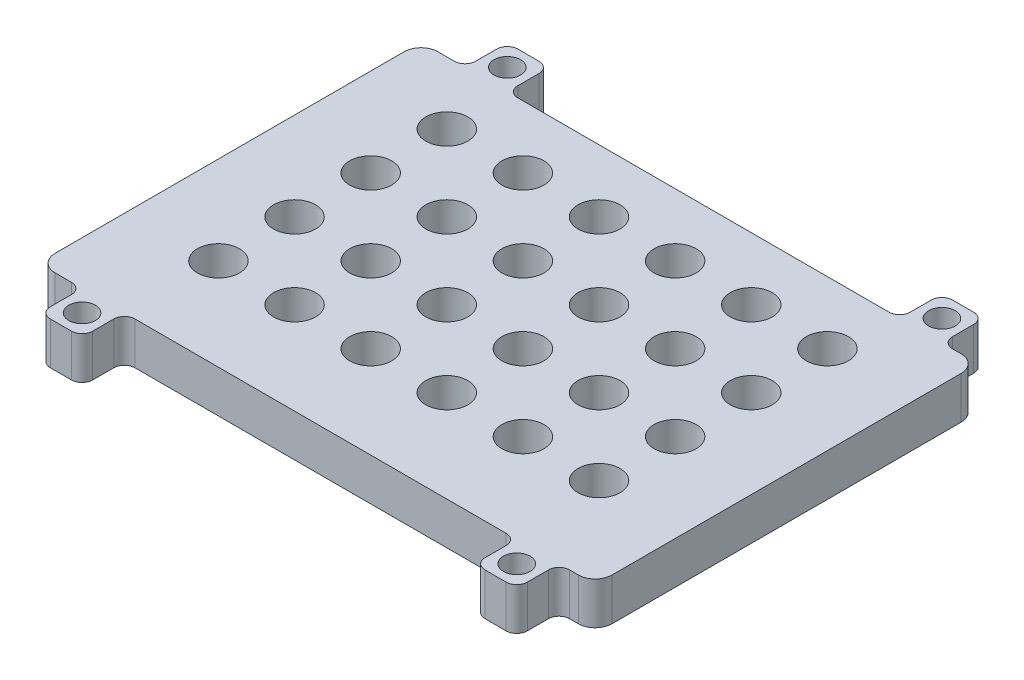
from build123d import *

# Parameters (mm, degrees)
SKETCH1_W           = 131.727
SKETCH1_H           = 90.551
SKETCH1_R           = 3.5
BOSS_EXTRUDE1_DEPTH = 10
SKETCH3_W           = 10
SKETCH3_H           = 10
BOSS_EXTRUDE3_DEPTH = 10
SKETCH4_R           = 3.15
CUT_EXTRUDE2_DEPTH  = 87.564320205
FILLET2_R           = 2.5
FILLET3_R           = 4
SKETCH5_R           = 4.975
CUT_EXTRUDE3_DEPTH  = 9.5


with BuildPart() as part:
    # Sketch1 → Boss-Extrude1 (new body)
    with BuildSketch(Plane(origin=(0, 0, 0), x_dir=(1, 0, 0), z_dir=(0, 1, 0))):
        Rectangle(SKETCH1_W, SKETCH1_H)
        with Locations(Location((-45, 30.5, 0), (0, 0, 270))):
            Circle(SKETCH1_R, mode=Mode.SUBTRACT)
        with Locations(Location((-27, 30.5, 0), (0, 0, 270))):
            Circle(SKETCH1_R, mode=Mode.SUBTRACT)
        with Locations(Location((-9, 30.5, 0), (0, 0, 270))):
            Circle(SKETCH1_R, mode=Mode.SUBTRACT)
        with Locations(Location((9, 30.5, 0), (0, 0, 270))):
            Circle(SKETCH1_R, mode=Mode.SUBTRACT)
        with Locations(Location((27, 30.5, 0), (0, 0, 270))):
            Circle(SKETCH1_R, mode=Mode.SUBTRACT)
        with Locations(Location((45, 30.5, 0), (0, 0, 270))):
            Circle(SKETCH1_R, mode=Mode.SUBTRACT)
        with Locations(Location((-27, 12.5, 0), (0, 0, 270))):
            Circle(SKETCH1_R, mode=Mode.SUBTRACT)
        with Locations(Location((-9, 12.5, 0), (0, 0, 270))):
            Circle(SKETCH1_R, mode=Mode.SUBTRACT)
        with Locations(Location((9, 12.5, 0), (0, 0, 270))):
            Circle(SKETCH1_R, mode=Mode.SUBTRACT)
        with Locations(Location((27, 12.5, 0), (0, 0, 270))):
            Circle(SKETCH1_R, mode=Mode.SUBTRACT)
        with Locations(Location((45, 12.5, 0), (0, 0, 270))):
            Circle(SKETCH1_R, mode=Mode.SUBTRACT)
        with Locations(Location((-27, -5.5, 0), (0, 0, 270))):
            Circle(SKETCH1_R, mode=Mode.SUBTRACT)
        with Locations(Location((-9, -5.5, 0), (0, 0, 270))):
            Circle(SKETCH1_R, mode=Mode.SUBTRACT)
        with Locations(Location((9, -5.5, 0), (0, 0, 270))):
            Circle(SKETCH1_R, mode=Mode.SUBTRACT)
        with Locations(Location((27, -5.5, 0), (0, 0, 270))):
            Circle(SKETCH1_R, mode=Mode.SUBTRACT)
        with Locations(Location((45, -5.5, 0), (0, 0, 270))):
            Circle(SKETCH1_R, mode=Mode.SUBTRACT)
        with Locations(Location((-27, -23.5, 0), (0, 0, 270))):
            Circle(SKETCH1_R, mode=Mode.SUBTRACT)
        with Locations(Location((-9, -23.5, 0), (0, 0, 270))):
            Circle(SKETCH1_R, mode=Mode.SUBTRACT)
        with Locations(Location((9, -23.5, 0), (0, 0, 270))):
            Circle(SKETCH1_R, mode=Mode.SUBTRACT)
        with Locations(Location((27, -23.5, 0), (0, 0, 270))):
            Circle(SKETCH1_R, mode=Mode.SUBTRACT)
        with Locations(Location((45, -23.5, 0), (0, 0, 270))):
            Circle(SKETCH1_R, mode=Mode.SUBTRACT)
        with Locations(Location((-45, 12.5, 0), (0, 0, 270))):
            Circle(SKETCH1_R, mode=Mode.SUBTRACT)
        with Locations(Location((-45, -5.5, 0), (0, 0, 270))):
            Circle(SKETCH1_R, mode=Mode.SUBTRACT)
        with Locations(Location((-45, -23.5, 0), (0, 0, 270))):
            Circle(SKETCH1_R, mode=Mode.SUBTRACT)
    extrude(amount=BOSS_EXTRUDE1_DEPTH)

    # Sketch3 → Boss-Extrude3 (add)
    with BuildSketch(Plane.XZ):
        with Locations((52.3134, -50.2755)):
            Rectangle(SKETCH3_W, SKETCH3_H)
        with Locations((-50.47267, -50.2755)):
            Rectangle(SKETCH3_W, SKETCH3_H)
        with Locations((-50.47267, 50.2755)):
            Rectangle(SKETCH3_W, SKETCH3_H)
        with Locations((52.3134, 50.2755)):
            Rectangle(SKETCH3_W, SKETCH3_H)
    extrude(amount=-BOSS_EXTRUDE3_DEPTH)

    # Sketch4 → Cut-Extrude2 (cut, through all)
    with BuildSketch(Plane(origin=(0, 0, 0), x_dir=(-1, 0, 0), z_dir=(0, -1, 0))):
        with Locations(Location((-52.3134, -50.2755, 0), (0, 0, 90))):
            Circle(SKETCH4_R)
        with Locations(Location((50.47267, -50.2755, 0), (0, 0, 90))):
            Circle(SKETCH4_R)
        with Locations(Location((50.47267, 50.2755, 0), (0, 0, 90))):
            Circle(SKETCH4_R)
        with Locations(Location((-52.3134, 50.2755, 0), (0, 0, 90))):
            Circle(SKETCH4_R)
    extrude(amount=-CUT_EXTRUDE2_DEPTH, mode=Mode.SUBTRACT)

    # Fillet2
    fillet2_edges = [part.edges().sort_by_distance(p)[0] for p in [
        (47.3134, 5, 55.2755),
        (47.3134, 5, 45.2755),
        (57.3134, 5, 55.2755),
        (57.3134, 5, 45.2755),
        (-45.47267, 5, 55.2755),
        (-45.47267, 5, 45.2755),
        (-55.47267, 5, 55.2755),
        (-55.47267, 5, 45.2755),
        (-45.47267, 5, -45.2755),
        (-45.47267, 5, -55.2755),
        (-55.47267, 5, -45.2755),
        (-55.47267, 5, -55.2755),
        (47.3134, 5, -45.2755),
        (47.3134, 5, -55.2755),
        (57.3134, 5, -45.2755),
        (57.3134, 5, -55.2755),
    ]]
    fillet(fillet2_edges, radius=FILLET2_R)

    # Fillet3
    fillet3_edges = [part.edges().sort_by_distance(p)[0] for p in [
        (-65.8635, 5, -45.2755),
        (-65.8635, 5, 45.2755),
        (65.8635, 5, 45.2755),
        (65.8635, 5, -45.2755),
    ]]
    fillet(fillet3_edges, radius=FILLET3_R)

    # Sketch5 → Cut-Extrude3 (cut)
    with BuildSketch(Plane(origin=(0, 10, 0), x_dir=(1, 0, 0), z_dir=(0, 1, 0))):
        with Locations(Location((45, -23.5, 0), (0, 0, 270))):
            Circle(SKETCH5_R)
        with Locations(Location((27, -23.5, 0), (0, 0, 270))):
            Circle(SKETCH5_R)
        with Locations(Location((9, -23.5, 0), (0, 0, 270))):
            Circle(SKETCH5_R)
        with Locations(Location((-9, -23.5, 0), (0, 0, 270))):
            Circle(SKETCH5_R)
        with Locations(Location((-27, -23.5, 0), (0, 0, 270))):
            Circle(SKETCH5_R)
        with Locations(Location((-45, -23.5, 0), (0, 0, 270))):
            Circle(SKETCH5_R)
        with Locations(Location((45, -5.5, 0), (0, 0, 270))):
            Circle(SKETCH5_R)
        with Locations(Location((27, -5.5, 0), (0, 0, 270))):
            Circle(SKETCH5_R)
        with Locations(Location((9, -5.5, 0), (0, 0, 270))):
            Circle(SKETCH5_R)
        with Locations(Location((-9, -5.5, 0), (0, 0, 270))):
            Circle(SKETCH5_R)
        with Locations(Location((-27, -5.5, 0), (0, 0, 270))):
            Circle(SKETCH5_R)
        with Locations(Location((-45, -5.5, 0), (0, 0, 270))):
            Circle(SKETCH5_R)
        with Locations(Location((45, 12.5, 0), (0, 0, 270))):
            Circle(SKETCH5_R)
        with Locations(Location((27, 12.5, 0), (0, 0, 270))):
            Circle(SKETCH5_R)
        with Locations(Location((9, 12.5, 0), (0, 0, 270))):
            Circle(SKETCH5_R)
        with Locations(Location((-9, 12.5, 0), (0, 0, 270))):
            Circle(SKETCH5_R)
        with Locations(Location((-27, 12.5, 0), (0, 0, 270))):
            Circle(SKETCH5_R)
        with Locations(Location((-45, 12.5, 0), (0, 0, 270))):
            Circle(SKETCH5_R)
        with Locations(Location((45, 30.5, 0), (0, 0, 270))):
            Circle(SKETCH5_R)
        with Locations(Location((27, 30.5, 0), (0, 0, 270))):
            Circle(SKETCH5_R)
        with Locations(Location((9, 30.5, 0), (0, 0, 270))):
            Circle(SKETCH5_R)
        with Locations(Location((-9, 30.5, 0), (0, 0, 270))):
            Circle(SKETCH5_R)
        with Locations(Location((-27, 30.5, 0), (0, 0, 270))):
            Circle(SKETCH5_R)
        with Locations(Location((-45, 30.5, 0), (0, 0, 270))):
            Circle(SKETCH5_R)
    extrude(amount=-CUT_EXTRUDE3_DEPTH, mode=Mode.SUBTRACT)


solid = part.part
